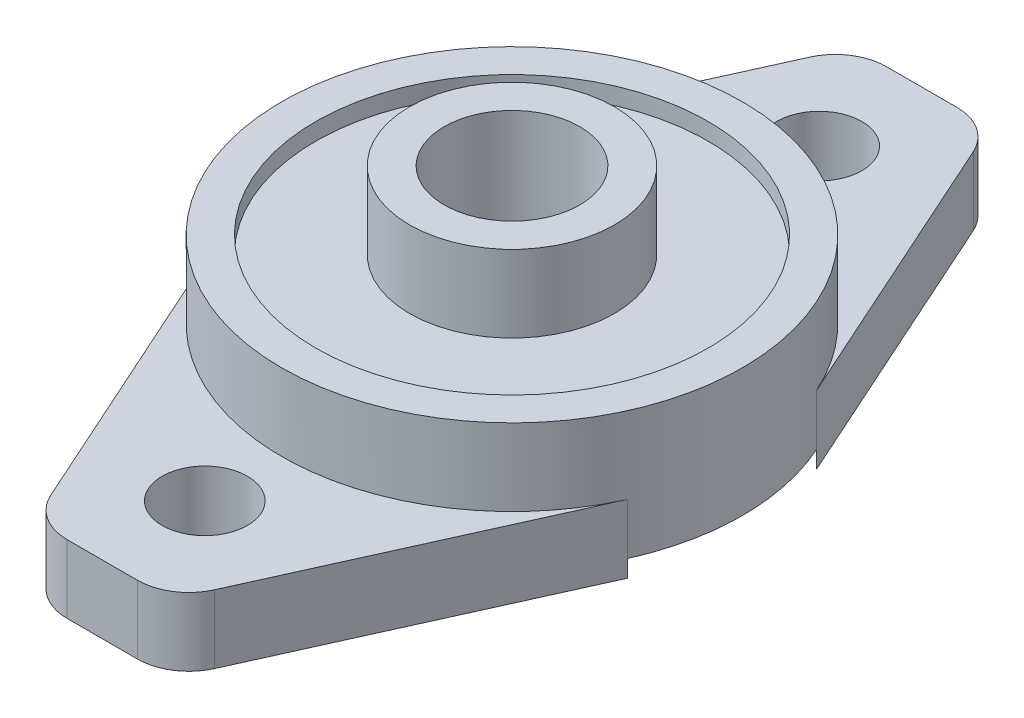
from build123d import *

# Parameters (mm, degrees)
SKETCH_1_R           = 2.5
SKETCH_1_R_2         = 13.5
SKETCH_1_R_3         = 4
EXTRUDE_1_DEPTH      = 4
SKETCH_1_3_R         = 13.5
SKETCH_1_3_R_2       = 4
EXTRUDE_2_DEPTH      = 8.5
SKETCH_1_5_R         = 13.5
SKETCH_1_5_R_2       = 4
CUT_EXTRUDE_1_DEPTH  = 1
EXTRUDE_4_DEPTH      = 1
EXTRUDE_4_DEPTH_BACK = 11
SKETCH_2_R           = 6
SKETCH_2_R_2         = 3.975020813
SKETCH_3_R           = 11.5
SKETCH_3_R_2         = 6
CUT_EXTRUDE_2_DEPTH  = 1
FILLET_1_R           = 3
CUT_EXTRUDE_START    = -6.5
SKETCH_3_2_R         = 11.5
SKETCH_3_2_R_2       = 6
CUT_EXTRUDE_3_DEPTH  = 1


with BuildPart() as part:
    # 草图1 → 凸台-拉伸1 (new body)
    # profile 1 of 3: a face of its own
    with BuildSketch(Plane(origin=(0, 0, 0), x_dir=(1, 0, 0), z_dir=(0, 1, 0))):
        with BuildLine():
            Line((4, 24), (-4, 24))
            Line((-4, 24), (-12.309965411, 5.542089098))
            ThreePointArc((-12.309965411, 5.542089098), (0, 13.5), (12.309965411, 5.542089098))
            Line((12.309965411, 5.542089098), (4, 24))
        make_face()
        with Locations(Location((0, 18, 0), (0, 0, 270))):
            Circle(SKETCH_1_R, mode=Mode.SUBTRACT)
    # profile 2 of 3: a face of its own
    with BuildSketch(Plane(origin=(0, 0, 0), x_dir=(1, 0, 0), z_dir=(0, 1, 0))):
        Circle(SKETCH_1_R_2)
        with Locations(Location((0, 0, 0), (0, 0, 270))):
            Circle(SKETCH_1_R_3, mode=Mode.SUBTRACT)
    # profile 3 of 3: a face of its own
    with BuildSketch(Plane(origin=(0, 0, 0), x_dir=(1, 0, 0), z_dir=(0, 1, 0))):
        with BuildLine():
            ThreePointArc((12.309965411, -5.542089098), (0, -13.5), (-12.309965411, -5.542089098))
            Line((-12.309965411, -5.542089098), (-4, -24))
            Line((-4, -24), (4, -24))
            Line((4, -24), (12.309965411, -5.542089098))
        make_face()
        with Locations(Location((0, -18, 0), (0, 0, 270))):
            Circle(SKETCH_1_R, mode=Mode.SUBTRACT)
    extrude(amount=EXTRUDE_1_DEPTH)

    # 草图1<3> → 凸台-拉伸2 (add)
    with BuildSketch(Plane(origin=(0, 0, 0), x_dir=(1, 0, 0), z_dir=(0, 1, 0))):
        with Locations(Location((0, 0, 0), (0, 0, 24.237826184))):
            Circle(SKETCH_1_3_R)
        with Locations(Location((0, 0, 0), (0, 0, 270))):
            Circle(SKETCH_1_3_R_2, mode=Mode.SUBTRACT)
    extrude(amount=EXTRUDE_2_DEPTH)

    # 草图1<5> → 切除-拉伸1 (cut)
    with BuildSketch(Plane(origin=(0, 0, 0), x_dir=(1, 0, 0), z_dir=(0, 1, 0))):
        with Locations(Location((0, 0, 0), (0, 0, 24.237826184))):
            Circle(SKETCH_1_5_R)
        with Locations(Location((0, 0, 0), (0, 0, 270))):
            Circle(SKETCH_1_5_R_2, mode=Mode.SUBTRACT)
    extrude(amount=CUT_EXTRUDE_1_DEPTH, mode=Mode.SUBTRACT)

    # 草图2 → 凸台-拉伸4 (add, two sides: drawn at the far end of the back side and taken through both)
    with BuildSketch(Plane.XZ.offset(-1).offset(-EXTRUDE_4_DEPTH_BACK)):
        with Locations(Location((0, 0, 0), (0, 0, 270))):
            Circle(SKETCH_2_R)
        with Locations(Location((0, 0, 0), (0, 0, 270))):
            Circle(SKETCH_2_R_2, mode=Mode.SUBTRACT)
    extrude(amount=EXTRUDE_4_DEPTH + EXTRUDE_4_DEPTH_BACK)

    # 草图3 → 切除-拉伸2 (cut)
    with BuildSketch(Plane(origin=(0, 8.5, 0), x_dir=(1, 0, 0), z_dir=(0, 1, 0))):
        with Locations(Location((0, 0, 0), (0, 0, 270))):
            Circle(SKETCH_3_R)
        with Locations(Location((0, 0, 0), (0, 0, 90))):
            Circle(SKETCH_3_R_2, mode=Mode.SUBTRACT)
    extrude(amount=-CUT_EXTRUDE_2_DEPTH, mode=Mode.SUBTRACT)

    # 圆角1
    fillet_1_edges = [part.edges().sort_by_distance(p)[0] for p in [
        (-4, 2, -24),
        (4, 2, -24),
        (4, 2, 24),
        (-4, 2, 24),
    ]]
    fillet(fillet_1_edges, radius=FILLET_1_R)

    # 草图3<2> → 切除-拉伸3 (cut)
    with BuildSketch(Plane(origin=(0, 8.5, 0), x_dir=(1, 0, 0), z_dir=(0, 1, 0)).offset(CUT_EXTRUDE_START)):
        with Locations(Location((0, 0, 0), (0, 0, 270))):
            Circle(SKETCH_3_2_R)
        with Locations(Location((0, 0, 0), (0, 0, 90))):
            Circle(SKETCH_3_2_R_2, mode=Mode.SUBTRACT)
    extrude(amount=-CUT_EXTRUDE_3_DEPTH, mode=Mode.SUBTRACT)


solid = part.part
